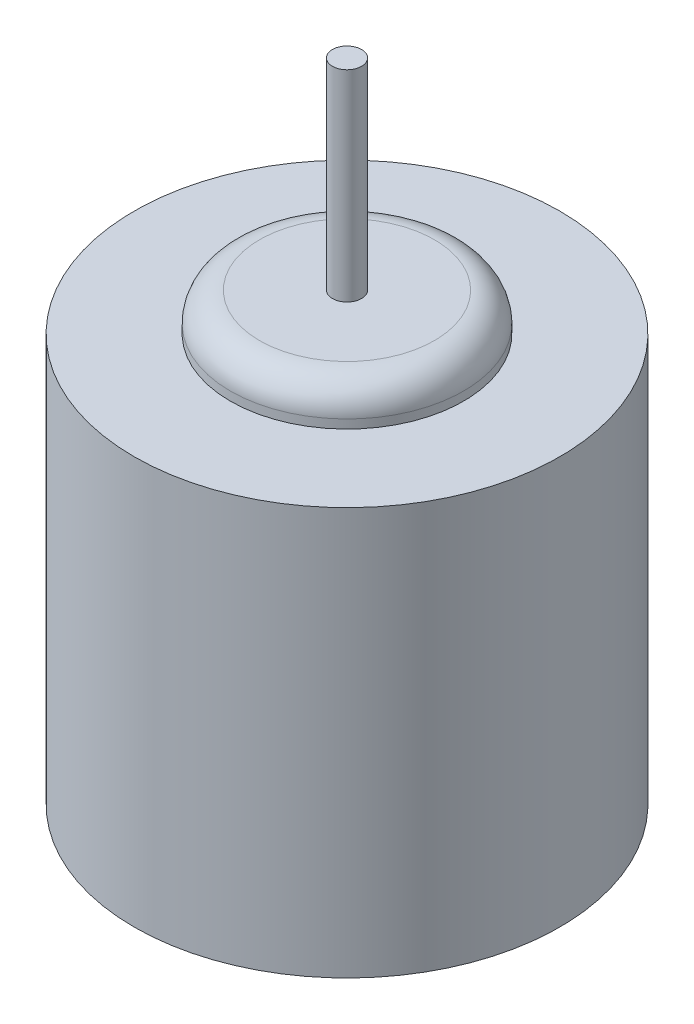
from build123d import *

# Parameters (mm, degrees)
SKETCH_1_R      = 14.6
EXTRUDE_1_DEPTH = 27.95
SKETCH_2_R      = 8
EXTRUDE_2_DEPTH = 2.6
FILLET_1_R      = 2
SKETCH_3_R      = 1
EXTRUDE_3_DEPTH = 13.8


with BuildPart() as part:
    # 草圖1 → 填料-伸長1 (new body)
    with BuildSketch(Plane(origin=(0, 0, 0), x_dir=(1, 0, 0), z_dir=(0, 1, 0))):
        with Locations(Location((0, 0, 0), (0, 0, 270))):
            Circle(SKETCH_1_R)
    extrude(amount=EXTRUDE_1_DEPTH)

    # 草圖2 → 填料-伸長2 (add)
    with BuildSketch(Plane(origin=(0, 27.95, 0), x_dir=(1, 0, 0), z_dir=(0, 1, 0))):
        with Locations(Location((0, 0, 0), (0, 0, 270))):
            Circle(SKETCH_2_R)
    extrude(amount=EXTRUDE_2_DEPTH)

    # 圓角1
    fillet_1_edges = [part.edges().sort_by_distance(p)[0] for p in [
        (0, 30.55, -8),
    ]]
    fillet(fillet_1_edges, radius=FILLET_1_R)

    # 草圖3 → 填料-伸長3 (add)
    with BuildSketch(Plane(origin=(0, 30.55, 0), x_dir=(1, 0, 0), z_dir=(0, 1, 0))):
        with Locations(Location((0, 0, 0), (0, 0, 90))):
            Circle(SKETCH_3_R)
    extrude(amount=EXTRUDE_3_DEPTH)


solid = part.part
